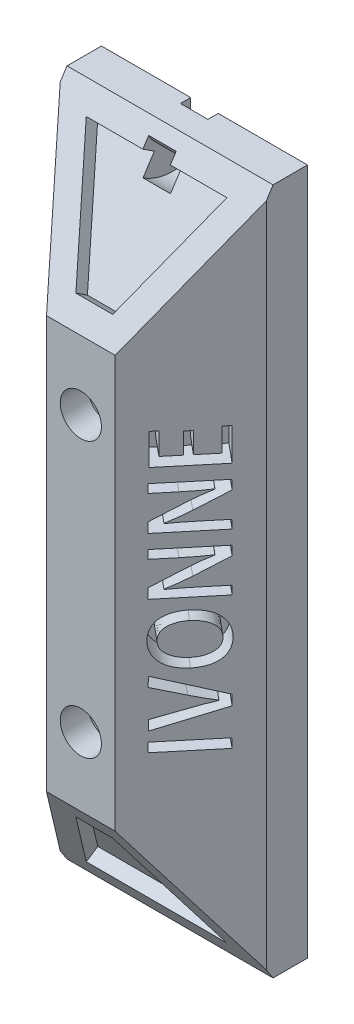
from build123d import *

# Parameters (mm, degrees)
SALIENTE_EXTRUIR1_DEPTH      = 50
CHAFL_N1_SIZE                = 10
CHAFL_N1_SIZE2               = 6.494075932
CORTAR_EXTRUIR1_DEPTH        = 1
CROQUIS4_R                   = 1.5
HUECOS_TORNILLOS_DEPTH       = 2
CROQUIS5_W                   = 0.666881583
CROQUIS5_H                   = 4.346222222
PUEBLA_1_DEPTH               = 1.8
PUEBLA_2_DEPTH               = 1.8
RANURA_LLAVERO_DEPTH         = 1
RANURA_LLAVERO_DEPTH_BACK    = 1
RANURA_LLAVERO_START         = -7.5
CROQUIS8_R                   = 4
CROQUIS8_R_2                 = 2
CROQUIS10_W                  = 2
CROQUIS10_H                  = 2
ESPACIO_LLAVERO_DEBAJO_DEPTH = 0.75
CROQUIS27_W                  = 5.291666667
CROQUIS27_H                  = 0.949786325
INVENTOTECA_DEBAJO_DEPTH     = 1
ROTAR_PARA_STL_ANGLE         = 90


with BuildPart() as part:
    # Croquis1 → Saliente-Extruir1 (new body)
    with BuildSketch(Plane.XY):
        Polygon((-7.5, 0), (7.5, 0), (7.5, 3), (2.5, 9), (-2.5, 9), (-7.5, 3), align=None)
    extrude(amount=SALIENTE_EXTRUIR1_DEPTH)

    # Chaflán1
    chafl_n1_edges = [part.edges().sort_by_distance(p)[0] for p in [
        (0, 9, 0),
        (0, 9, 50),
    ]]
    chafl_n1_side = [part.faces().sort_by_distance(p)[0] for p in [
        (0, 9, 25),
    ]]
    chamfer(chafl_n1_edges, length=CHAFL_N1_SIZE, length2=CHAFL_N1_SIZE2, reference=chafl_n1_side[0])

    # Croquis3 → Cortar-Extruir1 (cut)
    with BuildSketch(Plane(origin=(0, 24.601224047, 15.976221698), x_dir=(1, 0, 0), z_dir=(0, 0.838670567945425, 0.5446390350150255))):
        Polygon((-5.118051563, -38.768704331), (5.118051563, -38.768704331), (1.340238725, -30.445071403), (-1.340238725, -30.445071403), align=None)
    cortar_extruir1 = extrude(amount=-CORTAR_EXTRUIR1_DEPTH, mode=Mode.SUBTRACT)

    # Simetría1: Cortar-Extruir1 across plane
    add(cortar_extruir1.mirror(Plane.XY.offset(25)), mode=Mode.SUBTRACT)

    # Croquis4 → Huecos tornillos (cut)
    with BuildSketch(Plane(origin=(0, 9, 0), x_dir=(1, 0, 0), z_dir=(0, 1, 0))):
        with Locations(Location((0, -35, 0), (0, 0, 270))):
            Circle(CROQUIS4_R)
        with Locations(Location((0, -15, 0), (0, 0, 270))):
            Circle(CROQUIS4_R)
    extrude(amount=-HUECOS_TORNILLOS_DEPTH, mode=Mode.SUBTRACT)

    # Croquis5 → PUEBLA-1 (cut)
    # profile 1 of 6: a face of its own
    with BuildSketch(Plane(origin=(5.901639344, 4.918032787, 0), x_dir=(0, 0, -1), z_dir=(0.7682212795973757, 0.6401843996644802, 0))):
        with Locations((-34.829100393, 1.448221567)):
            Rectangle(CROQUIS5_W, CROQUIS5_H)
    # profile 2 of 6: a face of its own
    with BuildSketch(Plane(origin=(5.901639344, 4.918032787, 0), x_dir=(0, 0, -1), z_dir=(0.7682212795973757, 0.6401843996644802, 0))):
        with BuildLine():
            Line((-31.044933645, 3.616754674), (-31.658026888, 1.57311053))
            add(Edge.make_bspline(
                [(-31.658026888, 1.57311053), (-31.699446524, 1.433644653), (-31.781157246, 1.158512885), (-31.891992316, 0.747726513), (-31.991774138, 0.345276682), (-32.049946693, 0.078464754), (-32.078627409, -0.053081072)],
                knots=[0, 0, 0, 0, 1.039028323, 2.049746547, 3.038469889, 4, 4, 4, 4], degree=3))
            Line((-32.078627409, -0.053081072), (-32.095139663, -0.053081072))
            add(Edge.make_bspline(
                [(-32.095139663, -0.053081072), (-32.124240482, 0.078150514), (-32.182982573, 0.343050881), (-32.279959839, 0.742107749), (-32.386559732, 1.146590181), (-32.464636112, 1.416890509), (-32.504051355, 1.553346032)],
                knots=[0, 0, 0, 0, 0.972849241, 1.963765957, 2.972049415, 4, 4, 4, 4], degree=3))
            Line((-32.504051355, 1.553346032), (-33.07722421, 3.59709444))
            Line((-33.07722421, 3.59709444), (-33.79817645, 3.59709444))
            Line((-33.79817645, 3.59709444), (-32.481161335, -0.729817235))
            Line((-32.481161335, -0.729817235), (-31.748855517, -0.729817235))
            Line((-31.748855517, -0.729817235), (-30.341011773, 3.591417651))
            Line((-30.341011773, 3.591417651), (-31.044933645, 3.616754674))
        make_face()
    # profile 3 of 6: a face of its own
    with BuildSketch(Plane(origin=(5.901639344, 4.918032787, 0), x_dir=(0, 0, -1), z_dir=(0.7682212795973757, 0.6401843996644802, 0))):
        with BuildLine():
            add(Edge.make_bspline(
                [(-28.095886524, 3.677590478), (-28.16565393, 3.674703661), (-28.301888525, 3.669066582), (-28.500351425, 3.637948978), (-28.687856415, 3.590127123), (-28.8638204, 3.52225787), (-29.028802196, 3.436338959), (-29.182192859, 3.331377227), (-29.324241089, 3.208101346), (-29.454105977, 3.067251959), (-29.570480894, 2.910143798), (-29.67311558, 2.738438791), (-29.758767264, 2.551927808), (-29.830719285, 2.352304173), (-29.886017097, 2.138566438), (-29.926974813, 1.911296671), (-29.952499422, 1.669980416), (-29.957272341, 1.504404939), (-29.959720492, 1.419477107)],
                knots=[0, 0, 0, 0, 1.01693825, 1.985772131, 2.921518734, 3.832117633, 4.727948323, 5.626511184, 6.534414133, 7.463288783, 8.412839634, 9.378967074, 10.373196777, 11.399194858, 12.46754142, 13.586614818, 14.762113956, 16, 16, 16, 16], degree=3))
            add(Edge.make_bspline(
                [(-29.959720492, 1.419477107), (-29.957959694, 1.337819287), (-29.954518503, 1.17823251), (-29.928486567, 0.945750412), (-29.892381825, 0.725692531), (-29.837861372, 0.519245698), (-29.771826152, 0.324732128), (-29.687815848, 0.14447415), (-29.591815406, -0.024079988), (-29.480090002, -0.177828714), (-29.356409881, -0.317585189), (-29.219188749, -0.438958806), (-29.070392155, -0.542422431), (-28.909692435, -0.627705163), (-28.737003324, -0.69427954), (-28.552716146, -0.742476394), (-28.357044742, -0.773496795), (-28.222552549, -0.77882904), (-28.153721922, -0.781557985)],
                knots=[0, 0, 0, 0, 1.222557966, 2.38928844, 3.500048728, 4.559063003, 5.583344684, 6.572073494, 7.532658458, 8.483942143, 9.413076429, 10.322121769, 11.220566177, 12.121066096, 13.040014193, 13.985715855, 14.969126498, 16, 16, 16, 16], degree=3))
            add(Edge.make_bspline(
                [(-28.153721922, -0.781557985), (-28.087107481, -0.779835617), (-27.95635761, -0.776454977), (-27.765180171, -0.749513275), (-27.583334661, -0.706435416), (-27.411328861, -0.644593489), (-27.249400548, -0.564115067), (-27.096650747, -0.46690389), (-26.953736911, -0.351514936), (-26.820184012, -0.219547438), (-26.700208049, -0.068410971), (-26.593960448, 0.10020548), (-26.505916186, 0.288281456), (-26.432018411, 0.493369189), (-26.373836577, 0.716604884), (-26.33195802, 0.957517677), (-26.304433586, 1.216558697), (-26.29940249, 1.395314512), (-26.296803884, 1.487643492)],
                knots=[0, 0, 0, 0, 0.964759122, 1.89361537, 2.791129421, 3.668077106, 4.535429534, 5.405715028, 6.285894481, 7.191747456, 8.120239528, 9.075412678, 10.072429751, 11.12252868, 12.229792465, 13.410030886, 14.662257747, 16, 16, 16, 16], degree=3))
            add(Edge.make_bspline(
                [(-26.296803884, 1.487643492), (-26.298165742, 1.566264847), (-26.300828705, 1.720000314), (-26.323297248, 1.944837442), (-26.360382951, 2.157968607), (-26.41002484, 2.360356427), (-26.47484973, 2.551468015), (-26.554699401, 2.731206929), (-26.648962122, 2.899545815), (-26.755555285, 3.056601694), (-26.877422584, 3.198416988), (-27.01244475, 3.323110416), (-27.160793404, 3.42975367), (-27.323245735, 3.515553187), (-27.497756084, 3.58569348), (-27.686017754, 3.634760278), (-27.886806122, 3.667627428), (-28.025196732, 3.673940275), (-28.095886524, 3.677590478)],
                knots=[0, 0, 0, 0, 1.181997023, 2.311265979, 3.393394717, 4.432710499, 5.441572568, 6.423779709, 7.385757606, 8.339154063, 9.273212536, 10.190881701, 11.096730823, 12.012033381, 12.946898792, 13.918455472, 14.931549697, 16, 16, 16, 16], degree=3))
        make_face()
        with BuildLine():
            add(Edge.make_bspline(
                [(-28.118892037, 3.161002653), (-28.071512916, 3.156951548), (-27.978895026, 3.149032346), (-27.844708896, 3.120274594), (-27.720098234, 3.075968915), (-27.604941745, 3.016181642), (-27.500319293, 2.940460494), (-27.403837196, 2.851175381), (-27.318204101, 2.745795054), (-27.243781815, 2.626559028), (-27.178036276, 2.498359312), (-27.120843599, 2.364198736), (-27.070765031, 2.226045945), (-27.032031568, 2.082448402), (-27.000187523, 1.934815112), (-26.979607876, 1.782117173), (-26.965703299, 1.625057467), (-26.96436374, 1.51860995), (-26.963684666, 1.464647603)],
                knots=[0, 0, 0, 0, 0.999589655, 1.954022852, 2.877517249, 3.773878129, 4.673599429, 5.586311784, 6.531597741, 7.520501744, 8.537853166, 9.559417173, 10.586727125, 11.626167667, 12.685579831, 13.761408337, 14.865171654, 16, 16, 16, 16], degree=3))
            add(Edge.make_bspline(
                [(-26.963684666, 1.464647603), (-26.964748552, 1.405768414), (-26.966834463, 1.290326859), (-26.979747644, 1.120494803), (-27.002863157, 0.95789967), (-27.034489952, 0.801880421), (-27.076813162, 0.653415905), (-27.126307997, 0.511310028), (-27.186997569, 0.377126038), (-27.254794766, 0.250259062), (-27.332501035, 0.134116855), (-27.419449573, 0.031661097), (-27.51603858, -0.055935421), (-27.621401502, -0.1285927), (-27.736206003, -0.185943493), (-27.859826469, -0.227451483), (-27.992033451, -0.256501038), (-28.083757864, -0.262103157), (-28.130726033, -0.264971764)],
                knots=[0, 0, 0, 0, 1.215141369, 2.382468418, 3.512223075, 4.602497428, 5.664896563, 6.695933009, 7.704955915, 8.700973005, 9.661508233, 10.583141316, 11.467103885, 12.344670232, 13.216342825, 14.106081872, 15.030205112, 16, 16, 16, 16], degree=3))
            add(Edge.make_bspline(
                [(-28.130726033, -0.264971764), (-28.176863196, -0.261728608), (-28.267184607, -0.255379575), (-28.397927132, -0.226735966), (-28.520422776, -0.18428753), (-28.633727588, -0.126116877), (-28.738811667, -0.053984434), (-28.833999579, 0.034166827), (-28.922189649, 0.135814411), (-28.998687757, 0.252541056), (-29.067275621, 0.378648681), (-29.127067231, 0.511920214), (-29.178558591, 0.651135229), (-29.218847014, 0.796971302), (-29.252334036, 0.948158797), (-29.274719795, 1.105489402), (-29.289172555, 1.268638096), (-29.291058377, 1.37947624), (-29.292018429, 1.435902742)],
                knots=[0, 0, 0, 0, 0.968573833, 1.896149455, 2.796477749, 3.679461465, 4.558257033, 5.460120664, 6.392036362, 7.372592241, 8.379386201, 9.399199485, 10.432362265, 11.48798156, 12.568687675, 13.676620176, 14.817192429, 16, 16, 16, 16], degree=3))
            add(Edge.make_bspline(
                [(-29.292018429, 1.435902742), (-29.291675932, 1.490960072), (-29.290998413, 1.599873071), (-29.276923274, 1.760487246), (-29.256303781, 1.916713225), (-29.224695668, 2.067432112), (-29.185440967, 2.213487663), (-29.136947631, 2.354695724), (-29.078379989, 2.490508452), (-29.012881494, 2.62099997), (-28.937702264, 2.741583121), (-28.850709063, 2.848086982), (-28.753397428, 2.93889665), (-28.646047321, 3.014873272), (-28.528383149, 3.074985104), (-28.400902287, 3.120302247), (-28.263423937, 3.150432938), (-28.168109028, 3.157149779), (-28.118892037, 3.161002653)],
                knots=[0, 0, 0, 0, 1.136547726, 2.248289582, 3.326834991, 4.389002452, 5.425786828, 6.448433384, 7.469124786, 8.477926495, 9.461316408, 10.397265518, 11.309260955, 12.201738065, 13.104381261, 14.028854752, 14.989125284, 16, 16, 16, 16], degree=3))
        make_face(mode=Mode.SUBTRACT)
    # profile 4 of 6: a face of its own
    with BuildSketch(Plane(origin=(5.901639344, 4.918032787, 0), x_dir=(0, 0, -1), z_dir=(0.7682212795973757, 0.6401843996644802, 0))):
        with BuildLine():
            Line((-22.353831002, 3.621332678), (-22.968150553, 3.621332678))
            Line((-22.968150553, 3.621332678), (-22.968150553, 2.019323973))
            add(Edge.make_bspline(
                [(-22.968150553, 2.019323973), (-22.968422741, 1.934352967), (-22.96895716, 1.767518782), (-22.96509493, 1.521574845), (-22.96029327, 1.284217603), (-22.951838542, 0.979418847), (-22.934273891, 0.605224022), (-22.911397472, 0.307960084), (-22.899982564, 0.159630901)],
                knots=[0, 0, 0, 0, 0.821614023, 1.613177398, 2.378363483, 3.117216942, 4.56154481, 6, 6, 6, 6], degree=3))
            Line((-22.899982564, 0.159630901), (-22.91644429, 0.154316631))
            add(Edge.make_bspline(
                [(-22.91644429, 0.154316631), (-22.966176072, 0.273383065), (-23.067647266, 0.516322549), (-23.239367733, 0.878777373), (-23.423438637, 1.246232332), (-23.558281636, 1.487856823), (-23.625995631, 1.609193191)],
                knots=[0, 0, 0, 0, 0.955842181, 1.950270942, 2.970689279, 4, 4, 4, 4], degree=3))
            Line((-23.625995631, 1.609193191), (-24.768213277, 3.626260369))
            Line((-24.768213277, 3.626260369), (-25.491127289, 3.626260369))
            Line((-25.491127289, 3.626260369), (-25.491127289, -0.729817235))
            Line((-25.491127289, -0.729817235), (-24.876807737, -0.729817235))
            Line((-24.876807737, -0.729817235), (-24.876807737, 0.890671913))
            add(Edge.make_bspline(
                [(-24.876807737, 0.890671913), (-24.877033977, 0.983443472), (-24.877475191, 1.164367387), (-24.878912513, 1.428792907), (-24.882117927, 1.67901992), (-24.888814353, 1.989761231), (-24.899210027, 2.358125231), (-24.915074233, 2.647593449), (-24.922799515, 2.788553785)],
                knots=[0, 0, 0, 0, 0.879484195, 1.715177864, 2.506803862, 3.251809647, 4.661732754, 6, 6, 6, 6], degree=3))
            Line((-24.922799515, 2.788553785), (-24.899771545, 2.794646829))
            add(Edge.make_bspline(
                [(-24.899771545, 2.794646829), (-24.847097234, 2.669266241), (-24.740581837, 2.415727793), (-24.561916578, 2.041245353), (-24.372442614, 1.670054756), (-24.240252789, 1.425790794), (-24.174611841, 1.304497662)],
                knots=[0, 0, 0, 0, 0.984107413, 1.990013513, 3.00190943, 4, 4, 4, 4], degree=3))
            Line((-24.174611841, 1.304497662), (-23.025295401, -0.729817235))
            Line((-23.025295401, -0.729817235), (-22.353831002, -0.729817235))
            Line((-22.353831002, -0.729817235), (-22.353831002, 3.621332678))
        make_face()
    # profile 5 of 6: a face of its own
    with BuildSketch(Plane(origin=(5.901639344, 4.918032787, 0), x_dir=(0, 0, -1), z_dir=(0.7682212795973757, 0.6401843996644802, 0))):
        with BuildLine():
            Line((-18.20143047, 3.621332678), (-18.815750022, 3.621332678))
            Line((-18.815750022, 3.621332678), (-18.815750022, 2.019323973))
            add(Edge.make_bspline(
                [(-18.815750022, 2.019323973), (-18.816022209, 1.934352967), (-18.816556629, 1.767518782), (-18.812694399, 1.521574845), (-18.807892738, 1.284217603), (-18.799438011, 0.979418847), (-18.78187336, 0.605224022), (-18.758996941, 0.307960084), (-18.747582033, 0.159630901)],
                knots=[0, 0, 0, 0, 0.821614023, 1.613177398, 2.378363483, 3.117216942, 4.56154481, 6, 6, 6, 6], degree=3))
            Line((-18.747582033, 0.159630901), (-18.764043759, 0.154316631))
            add(Edge.make_bspline(
                [(-18.764043759, 0.154316631), (-18.81377554, 0.273383065), (-18.915246735, 0.516322549), (-19.086967202, 0.878777373), (-19.271038106, 1.246232332), (-19.405881105, 1.487856823), (-19.4735951, 1.609193191)],
                knots=[0, 0, 0, 0, 0.955842181, 1.950270942, 2.970689279, 4, 4, 4, 4], degree=3))
            Line((-19.4735951, 1.609193191), (-20.615812746, 3.626260369))
            Line((-20.615812746, 3.626260369), (-21.338726758, 3.626260369))
            Line((-21.338726758, 3.626260369), (-21.338726758, -0.729817235))
            Line((-21.338726758, -0.729817235), (-20.724407206, -0.729817235))
            Line((-20.724407206, -0.729817235), (-20.724407206, 0.890671913))
            add(Edge.make_bspline(
                [(-20.724407206, 0.890671913), (-20.724633446, 0.983443472), (-20.72507466, 1.164367387), (-20.726511982, 1.428792907), (-20.729717396, 1.67901992), (-20.736413822, 1.989761231), (-20.746809496, 2.358125231), (-20.762673702, 2.647593449), (-20.770398984, 2.788553785)],
                knots=[0, 0, 0, 0, 0.879484195, 1.715177864, 2.506803862, 3.251809647, 4.661732754, 6, 6, 6, 6], degree=3))
            Line((-20.770398984, 2.788553785), (-20.747371014, 2.794646829))
            add(Edge.make_bspline(
                [(-20.747371014, 2.794646829), (-20.694696703, 2.669266241), (-20.588181306, 2.415727793), (-20.409516047, 2.041245353), (-20.220042083, 1.670054756), (-20.087852258, 1.425790794), (-20.02221131, 1.304497662)],
                knots=[0, 0, 0, 0, 0.984107413, 1.990013513, 3.00190943, 4, 4, 4, 4], degree=3))
            Line((-20.02221131, 1.304497662), (-18.87289487, -0.729817235))
            Line((-18.87289487, -0.729817235), (-18.20143047, -0.729817235))
            Line((-18.20143047, -0.729817235), (-18.20143047, 3.621332678))
        make_face()
    # profile 6 of 6: a face of its own
    with BuildSketch(Plane(origin=(5.901639344, 4.918032787, 0), x_dir=(0, 0, -1), z_dir=(0.7682212795973757, 0.6401843996644802, 0))):
        Polygon((-14.810731067, -0.211998289), (-16.519444643, -0.211998289), (-16.519444643, 1.268770301), (-14.998065114, 1.268770301), (-14.998065114, 1.785358127), (-16.519444643, 1.785358127), (-16.519444643, 3.055878589), (-14.907236485, 3.055878589), (-14.907236485, 3.572466414), (-17.186326227, 3.572466414), (-17.186326227, -0.728586114), (-14.810731067, -0.728586114), align=None)
    extrude(amount=-PUEBLA_1_DEPTH, mode=Mode.SUBTRACT)

    # Croquis7 → PUEBLA-2 (cut)
    # profile 1 of 6: a face of its own
    with BuildSketch(Plane(origin=(-5.901639344, 4.918032787, 0), x_dir=(0, 0, 1), z_dir=(-0.7682212795973757, 0.6401843996644802, 0))):
        with BuildLine():
            Line((14.784896784, -0.728547254), (15.451778367, -0.728547254))
            Line((15.451778367, -0.728547254), (15.451778367, 0.974180749))
            add(Edge.make_bspline(
                [(15.451778367, 0.974180749), (15.479649087, 0.969236748), (15.537061979, 0.959052245), (15.626564776, 0.950753646), (15.721366907, 0.945554573), (15.786305691, 0.945648321), (15.819712592, 0.945696549)],
                knots=[0, 0, 0, 0, 0.918571729, 1.892231672, 2.915686383, 4, 4, 4, 4], degree=3))
            add(Edge.make_bspline(
                [(15.819712592, 0.945696549), (15.870388914, 0.945724228), (15.97055983, 0.94577894), (16.118738391, 0.959670366), (16.263190986, 0.982345226), (16.403847566, 1.015986552), (16.540641355, 1.060797786), (16.673868346, 1.114904749), (16.803241441, 1.179284973), (16.927989135, 1.253088297), (17.044445678, 1.33944952), (17.147471564, 1.441403104), (17.234751392, 1.558270637), (17.307710526, 1.688949237), (17.365805129, 1.833333354), (17.409189057, 1.991763888), (17.438096909, 2.164059154), (17.444833096, 2.283998338), (17.448314303, 2.345981934)],
                knots=[0, 0, 0, 0, 1.002223409, 1.981075816, 2.941057117, 3.893567037, 4.839120738, 5.786658294, 6.736252809, 7.695867274, 8.651375827, 9.597441389, 10.552949943, 11.527852714, 12.550822771, 13.624507394, 14.772364707, 16, 16, 16, 16], degree=3))
            add(Edge.make_bspline(
                [(17.448314303, 2.345981934), (17.446179168, 2.394510672), (17.442011002, 2.489247473), (17.421235816, 2.626762618), (17.389266165, 2.755805686), (17.345887418, 2.876709323), (17.289686702, 2.988600376), (17.222653702, 3.092465215), (17.143832035, 3.187785686), (17.082474587, 3.242995652), (17.051635218, 3.270745185)],
                knots=[0, 0, 0, 0, 1.121960372, 2.190267843, 3.207584746, 4.190239261, 5.152208329, 6.094546313, 7.042284316, 8, 8, 8, 8], degree=3))
            add(Edge.make_bspline(
                [(17.051635218, 3.270745185), (17.016952224, 3.298731673), (16.946495047, 3.355585154), (16.826534971, 3.425932051), (16.69479849, 3.485606729), (16.550814177, 3.535204926), (16.394020658, 3.572753107), (16.224702151, 3.597909169), (16.04318639, 3.615259844), (15.918036956, 3.616622263), (15.853385143, 3.617326084)],
                knots=[0, 0, 0, 0, 0.838628006, 1.70364077, 2.610636308, 3.559859354, 4.568055018, 5.643200099, 6.782484425, 8, 8, 8, 8], degree=3))
            add(Edge.make_bspline(
                [(15.853385143, 3.617326084), (15.798904277, 3.616347806), (15.692664664, 3.61444013), (15.537682814, 3.609712771), (15.391181981, 3.602440724), (15.25322065, 3.592351175), (15.123638459, 3.581283174), (15.002589421, 3.567296885), (14.890302472, 3.551073558), (14.818537901, 3.538128867), (14.784076304, 3.531912782)],
                knots=[0, 0, 0, 0, 1.217605855, 2.374374404, 3.464660226, 4.494999595, 5.465333604, 6.370582827, 7.217548217, 8, 8, 8, 8], degree=3))
            Line((14.784076304, 3.531912782), (14.784896784, -0.728547254))
        make_face()
        with BuildLine():
            add(Edge.make_bspline(
                [(15.451778367, 3.061940716), (15.477458014, 3.066999921), (15.535600933, 3.078454789), (15.634998692, 3.088975362), (15.756359022, 3.097021773), (15.844882289, 3.099433961), (15.892806667, 3.100739862)],
                knots=[0, 0, 0, 0, 0.7081459, 1.603358068, 2.702515415, 4, 4, 4, 4], degree=3))
            add(Edge.make_bspline(
                [(15.892806667, 3.100739862), (15.925402935, 3.100059102), (15.989080716, 3.098729215), (16.082194342, 3.089818951), (16.170284081, 3.074138278), (16.253491127, 3.052795472), (16.331865308, 3.02610562), (16.404867049, 2.991858619), (16.472939866, 2.951893235), (16.535615875, 2.905588177), (16.592916539, 2.854060564), (16.6422308, 2.795232649), (16.684691459, 2.730579305), (16.7190514, 2.659519427), (16.7462214, 2.582653608), (16.765834456, 2.499791745), (16.778255916, 2.410954941), (16.780355219, 2.349582306), (16.781433522, 2.318058354)],
                knots=[0, 0, 0, 0, 1.16517395, 2.276202082, 3.339667925, 4.360262278, 5.344409501, 6.294443781, 7.237649562, 8.161467064, 9.075802852, 9.985465996, 10.897442204, 11.83402534, 12.799705885, 13.806079676, 14.873096483, 16, 16, 16, 16], degree=3))
            add(Edge.make_bspline(
                [(16.781433522, 2.318058354), (16.780331411, 2.284624958), (16.77818289, 2.219447885), (16.766037749, 2.1247713), (16.74534889, 2.03626464), (16.717396737, 1.953694268), (16.682319389, 1.876728647), (16.638246382, 1.806205479), (16.586102543, 1.741979405), (16.526818461, 1.683321026), (16.460251877, 1.631673222), (16.386945276, 1.587186303), (16.308067555, 1.548225155), (16.222344642, 1.517168035), (16.130335292, 1.493769508), (16.032485225, 1.475343362), (15.92806913, 1.464940187), (15.856418101, 1.463182963), (15.819712592, 1.46228277)],
                knots=[0, 0, 0, 0, 1.098810706, 2.142087657, 3.130558938, 4.080710143, 5.002414742, 5.90351999, 6.805477983, 7.715119197, 8.638227497, 9.567016518, 10.528554789, 11.524610674, 12.556657526, 13.645294696, 14.7937276, 16, 16, 16, 16], degree=3))
            add(Edge.make_bspline(
                [(15.819712592, 1.46228277), (15.783838455, 1.46215923), (15.715320982, 1.461923276), (15.618009798, 1.467773977), (15.530739349, 1.477388261), (15.477149605, 1.489989473), (15.451778367, 1.495955322)],
                knots=[0, 0, 0, 0, 1.161542367, 2.218477041, 3.156565424, 4, 4, 4, 4], degree=3))
            Line((15.451778367, 1.495955322), (15.451778367, 3.061940716))
        make_face(mode=Mode.SUBTRACT)
    # profile 2 of 6: a face of its own
    with BuildSketch(Plane(origin=(-5.901639344, 4.918032787, 0), x_dir=(0, 0, 1), z_dir=(-0.7682212795973757, 0.6401843996644802, 0))):
        with BuildLine():
            Line((21.338725154, 3.594040661), (20.67184357, 3.594040661))
            Line((20.67184357, 3.594040661), (20.67184357, 0.96568722))
            add(Edge.make_bspline(
                [(20.67184357, 0.96568722), (20.670344571, 0.913835752), (20.667440856, 0.81339417), (20.656438589, 0.668187154), (20.637725128, 0.533725361), (20.611704638, 0.410118429), (20.578263822, 0.297074009), (20.537391283, 0.194981263), (20.489488882, 0.103425588), (20.434564862, 0.022452272), (20.372145654, -0.047802667), (20.304755279, -0.109211986), (20.23119013, -0.160312362), (20.152053056, -0.202040322), (20.067227678, -0.233747224), (19.977007568, -0.257065903), (19.881067112, -0.270173821), (19.815287553, -0.271555951), (19.781575757, -0.272264287)],
                knots=[0, 0, 0, 0, 1.438585386, 2.786686621, 4.036552978, 5.201082612, 6.286862056, 7.302011853, 8.246194207, 9.147550894, 10.00824043, 10.846879081, 11.670430889, 12.485539397, 13.321768657, 14.176240106, 15.065329361, 16, 16, 16, 16], degree=3))
            add(Edge.make_bspline(
                [(19.781575757, -0.272264287), (19.750320718, -0.271901843), (19.689150878, -0.271192498), (19.599783951, -0.257740325), (19.515263468, -0.234523239), (19.435132311, -0.202206839), (19.359012765, -0.161455043), (19.288835008, -0.10942559), (19.222629615, -0.049035341), (19.160868087, 0.020718107), (19.105307553, 0.10140995), (19.057283349, 0.192788231), (19.015700483, 0.295023948), (18.983048473, 0.408366404), (18.955568039, 0.532277433), (18.936456753, 0.667087865), (18.923979896, 0.81269346), (18.921931424, 0.913365624), (18.920872482, 0.965407311)],
                knots=[0, 0, 0, 0, 0.880620858, 1.723480129, 2.540049658, 3.347149052, 4.155502796, 4.967718036, 5.803797264, 6.678919068, 7.589027408, 8.559476972, 9.584493291, 10.69587747, 11.881568968, 13.161133164, 14.532470029, 16, 16, 16, 16], degree=3))
            Line((18.920872482, 0.965407311), (18.920872482, 3.594040661))
            Line((18.920872482, 3.594040661), (18.253990898, 3.594040661))
            Line((18.253990898, 3.594040661), (18.253990898, 1.005424745))
            add(Edge.make_bspline(
                [(18.253990898, 1.005424745), (18.255679837, 0.927970745), (18.25894061, 0.778433144), (18.280640329, 0.56285405), (18.313771248, 0.364027903), (18.359309913, 0.181964958), (18.417293993, 0.016667686), (18.4880826, -0.131682311), (18.571200409, -0.263581208), (18.667177235, -0.378625039), (18.774028522, -0.477361026), (18.889082518, -0.562850203), (19.013100737, -0.634697264), (19.14596537, -0.692950344), (19.287063789, -0.738507941), (19.43688367, -0.769183087), (19.594930597, -0.787937967), (19.703226031, -0.788541844), (19.758579868, -0.788850508)],
                knots=[0, 0, 0, 0, 1.38962604, 2.682900096, 3.883708864, 5.003577014, 6.046051179, 7.021519621, 7.946782916, 8.836077995, 9.701502405, 10.551298335, 11.403065278, 12.267387725, 13.149723428, 14.058184006, 15.007465389, 16, 16, 16, 16], degree=3))
            add(Edge.make_bspline(
                [(19.758579868, -0.788850508), (19.816399624, -0.788274185), (19.929363758, -0.787148205), (20.094242877, -0.767572176), (20.250524877, -0.735911185), (20.398044536, -0.690263513), (20.536286113, -0.629206856), (20.666763255, -0.556748621), (20.787110006, -0.468286382), (20.899991479, -0.36815304), (21.001724586, -0.251677169), (21.089883419, -0.11810524), (21.164665605, 0.031745997), (21.226195617, 0.198120896), (21.274126192, 0.380848286), (21.308762009, 0.580045987), (21.332383138, 0.795401478), (21.336022541, 0.944808997), (21.337904674, 1.022075752)],
                knots=[0, 0, 0, 0, 1.011965347, 1.977106012, 2.902281606, 3.801441794, 4.675206323, 5.544580214, 6.409541179, 7.285433736, 8.18245704, 9.109221175, 10.080450816, 11.108962635, 12.210199246, 13.38382548, 14.647033859, 16, 16, 16, 16], degree=3))
            Line((21.337904674, 1.022075752), (21.338725154, 3.594040661))
        make_face()
    # profile 3 of 6: a face of its own
    with BuildSketch(Plane(origin=(-5.901639344, 4.918032787, 0), x_dir=(0, 0, 1), z_dir=(-0.7682212795973757, 0.6401843996644802, 0))):
        Polygon((24.729424557, -0.219290812), (23.020710981, -0.219290812), (23.020710981, 1.261477778), (24.54209051, 1.261477778), (24.54209051, 1.778065603), (23.020710981, 1.778065603), (23.020710981, 3.048586065), (24.632919139, 3.048586065), (24.632919139, 3.56517389), (22.353829397, 3.56517389), (22.353829397, -0.735878638), (24.729424557, -0.735878638), align=None)
    # profile 4 of 6: a face of its own
    with BuildSketch(Plane(origin=(-5.901639344, 4.918032787, 0), x_dir=(0, 0, 1), z_dir=(-0.7682212795973757, 0.6401843996644802, 0))):
        with BuildLine():
            add(Edge.make_bspline(
                [(27.427912571, 1.600288581), (27.457304513, 1.611091676), (27.51499113, 1.632294562), (27.596974007, 1.670456731), (27.674335394, 1.711640989), (27.74604166, 1.757174888), (27.812449258, 1.807236199), (27.874162796, 1.860223711), (27.930244684, 1.917933777), (27.980136332, 1.979509761), (28.024529145, 2.043967058), (28.06432428, 2.110230105), (28.097196457, 2.179314638), (28.123294998, 2.250722633), (28.145244396, 2.323760192), (28.159512944, 2.399480878), (28.168998425, 2.477147825), (28.170306483, 2.529646513), (28.170968839, 2.556230062)],
                knots=[0, 0, 0, 0, 1.158010079, 2.272789037, 3.3421568, 4.398545089, 5.411311129, 6.416452725, 7.404821061, 8.383909716, 9.344703944, 10.298264987, 11.240518476, 12.169838246, 13.108875005, 14.058285776, 15.016782025, 16, 16, 16, 16], degree=3))
            add(Edge.make_bspline(
                [(28.170968839, 2.556230062), (28.172279888, 2.586360359), (28.174920164, 2.647038747), (28.1648979, 2.738188909), (28.146460736, 2.829594294), (28.115096551, 2.92003336), (28.074763229, 3.011315638), (28.022727489, 3.10198126), (27.960430361, 3.19266422), (27.888837475, 3.283911598), (27.800622897, 3.371228404), (27.6891127, 3.445819599), (27.557141455, 3.509217149), (27.405275975, 3.563523581), (27.232137514, 3.604855416), (27.039154019, 3.638773151), (26.824753378, 3.660200303), (26.674911301, 3.666562085), (26.596571723, 3.669888116)],
                knots=[0, 0, 0, 0, 0.662582201, 1.334351894, 2.01115102, 2.710095991, 3.435323525, 4.2039863, 5.00579069, 5.854169704, 6.752811591, 7.723346771, 8.789937867, 9.967205469, 11.26427748, 12.700938597, 14.275203597, 16, 16, 16, 16], degree=3))
            add(Edge.make_bspline(
                [(26.596571723, 3.669888116), (26.498805662, 3.668361581), (26.307727032, 3.665378049), (26.0730719, 3.648489356), (25.896136507, 3.629630675), (25.774738941, 3.614322774), (25.663624979, 3.596253201), (25.59293774, 3.582708731), (25.559292872, 3.576261996)],
                knots=[0, 0, 0, 0, 1.687173059, 3.297491112, 4.057661749, 4.757936521, 5.408817464, 6, 6, 6, 6], degree=3))
            Line((25.559292872, 3.576261996), (25.560113352, -0.736201857))
            add(Edge.make_bspline(
                [(25.560113352, -0.736201857), (25.585547474, -0.739997093), (25.639571911, -0.748058528), (25.725952737, -0.756403848), (25.821729996, -0.765002982), (25.927225423, -0.770834209), (26.042143949, -0.778075993), (26.166755119, -0.782405338), (26.300610405, -0.786916615), (26.392889841, -0.788192068), (26.440528191, -0.788850508)],
                knots=[0, 0, 0, 0, 0.699185398, 1.485134748, 2.359315875, 3.314070099, 4.357999124, 5.490443077, 6.704465959, 8, 8, 8, 8], degree=3))
            add(Edge.make_bspline(
                [(26.440528191, -0.788850508), (26.48378965, -0.788923283), (26.568701305, -0.78906612), (26.693539879, -0.783382296), (26.813576544, -0.776736153), (26.928598488, -0.76501384), (27.038367936, -0.750117718), (27.143461599, -0.733282693), (27.243151078, -0.711870868), (27.33801951, -0.687356338), (27.427435692, -0.659109285), (27.512380306, -0.629476055), (27.591546737, -0.594292022), (27.666137843, -0.557009696), (27.735789358, -0.515838622), (27.799466933, -0.470372146), (27.859339319, -0.423036282), (27.895295218, -0.388103169), (27.913086369, -0.370818097)],
                knots=[0, 0, 0, 0, 1.322760237, 2.59625459, 3.820847638, 4.998735831, 6.130623795, 7.208270984, 8.252558636, 9.247527692, 10.203409462, 11.119645776, 11.996881918, 12.850511325, 13.668888328, 14.467895536, 15.241907374, 16, 16, 16, 16], degree=3))
            add(Edge.make_bspline(
                [(27.913086369, -0.370818097), (27.934033209, -0.350679608), (27.977990659, -0.3084185), (28.03861953, -0.233634953), (28.097299965, -0.145758404), (28.156484425, -0.046274736), (28.207947848, 0.069052468), (28.245368869, 0.201407126), (28.268775719, 0.349753118), (28.273582064, 0.454207549), (28.276092903, 0.508774658)],
                knots=[0, 0, 0, 0, 0.711698037, 1.493515599, 2.35333271, 3.30048251, 4.327872579, 5.4385067, 6.661873096, 8, 8, 8, 8], degree=3))
            add(Edge.make_bspline(
                [(28.276092903, 0.508774658), (28.274373239, 0.546036005), (28.271025285, 0.618578785), (28.258270066, 0.72447263), (28.236390449, 0.823945101), (28.209164698, 0.918373297), (28.17234641, 1.00620298), (28.130231119, 1.089193597), (28.078530193, 1.164784732), (28.021020206, 1.234833489), (27.957672357, 1.298412998), (27.891153842, 1.35671313), (27.821936669, 1.409728807), (27.749391173, 1.456562791), (27.673862187, 1.498057024), (27.594317222, 1.532075841), (27.512640376, 1.562378214), (27.456059678, 1.576670867), (27.427708855, 1.583832469)],
                knots=[0, 0, 0, 0, 1.205821652, 2.347570949, 3.442991661, 4.495930151, 5.519937987, 6.51755612, 7.49950264, 8.474121847, 9.444229276, 10.39759717, 11.33229336, 12.260302398, 13.187086564, 14.114546721, 15.055258179, 16, 16, 16, 16], degree=3))
            Line((27.427708855, 1.583832469), (27.427912571, 1.600288581))
        make_face()
        with BuildLine():
            Line((26.226994935, 1.779296724), (26.226994935, 3.1189813))
            add(Edge.make_bspline(
                [(26.226994935, 3.1189813), (26.237376504, 3.121480625), (26.259923636, 3.126908766), (26.297159993, 3.133604956), (26.340866843, 3.137848569), (26.390906942, 3.143154438), (26.447614778, 3.146972396), (26.51057095, 3.150539447), (26.579875371, 3.151609452), (26.628055607, 3.152720915), (26.653240164, 3.153301895)],
                knots=[0, 0, 0, 0, 0.598125682, 1.299034808, 2.116997753, 3.056965804, 4.117876534, 5.300287432, 6.588818354, 8, 8, 8, 8], degree=3))
            add(Edge.make_bspline(
                [(26.653240164, 3.153301895), (26.706982181, 3.153073832), (26.811774752, 3.152629129), (26.964389556, 3.128258542), (27.106876897, 3.085176014), (27.217933297, 3.034910316), (27.297923748, 2.982299925), (27.351257224, 2.935384468), (27.395997753, 2.879272351), (27.432980164, 2.81549156), (27.462499309, 2.744192649), (27.4848695, 2.665436734), (27.498353308, 2.578543132), (27.502125523, 2.517946933), (27.504088058, 2.486421113)],
                knots=[0, 0, 0, 0, 1.568793518, 3.05902002, 4.496583038, 5.910283965, 6.602575845, 7.288225433, 7.9766698, 8.690178237, 9.436053456, 10.226181897, 11.077152205, 12, 12, 12, 12], degree=3))
            add(Edge.make_bspline(
                [(27.504088058, 2.486421113), (27.502951902, 2.46091218), (27.500717372, 2.41074256), (27.488720885, 2.337384437), (27.471557869, 2.267241155), (27.444323347, 2.201825255), (27.411400987, 2.139891474), (27.371951833, 2.08113616), (27.324696439, 2.026663861), (27.27048762, 1.976821289), (27.210169996, 1.93157236), (27.144539642, 1.890950204), (27.07261382, 1.857607194), (26.995944089, 1.829700634), (26.913926944, 1.807009031), (26.826067217, 1.792447341), (26.733195926, 1.780908144), (26.669430901, 1.779299222), (26.636814529, 1.778476244)],
                knots=[0, 0, 0, 0, 0.975427607, 1.918419381, 2.837405929, 3.729535512, 4.619205739, 5.516233806, 6.429000407, 7.369665814, 8.326325266, 9.308245348, 10.314901143, 11.351316717, 12.425366266, 13.562823508, 14.753362722, 16, 16, 16, 16], degree=3))
            Line((26.636814529, 1.778476244), (26.226994935, 1.779296724))
        make_face(mode=Mode.SUBTRACT)
        with BuildLine():
            Line((26.226994935, 1.312808689), (26.614378459, 1.312808689))
            add(Edge.make_bspline(
                [(26.614378459, 1.312808689), (26.646229576, 1.312296431), (26.709383706, 1.311280731), (26.802871038, 1.304376544), (26.893223241, 1.289785034), (26.9808127, 1.271660165), (27.06466495, 1.245321091), (27.146439946, 1.215684201), (27.224527191, 1.177918983), (27.299862199, 1.136327164), (27.369256135, 1.087071777), (27.430943419, 1.030163723), (27.482777032, 0.964355938), (27.526740215, 0.891676716), (27.561451245, 0.810985511), (27.586605453, 0.722640481), (27.60304495, 0.626772534), (27.607113511, 0.560305849), (27.609212122, 0.526021574)],
                knots=[0, 0, 0, 0, 1.068740361, 2.119089545, 3.141435227, 4.137701909, 5.116886027, 6.087633407, 7.053152307, 8.023812777, 8.971962115, 9.901283631, 10.829378799, 11.772934645, 12.743812377, 13.767024156, 14.848205587, 16, 16, 16, 16], degree=3))
            add(Edge.make_bspline(
                [(27.609212122, 0.526021574), (27.60741895, 0.491463382), (27.603957175, 0.424747691), (27.587970734, 0.328488889), (27.564597529, 0.23970842), (27.532562462, 0.158070882), (27.491079817, 0.084525426), (27.441749423, 0.018169654), (27.383107825, -0.040127084), (27.316734265, -0.090572584), (27.243993024, -0.133710946), (27.167421985, -0.171713066), (27.086622997, -0.203695607), (27.002134096, -0.230079516), (26.913355202, -0.249762582), (26.820859922, -0.263390925), (26.724313931, -0.272139815), (26.658734723, -0.27222227), (26.625316584, -0.272264287)],
                knots=[0, 0, 0, 0, 1.156628522, 2.232908233, 3.256814316, 4.22257225, 5.157273822, 6.072900156, 6.979323982, 7.913307726, 8.853910476, 9.803914165, 10.7696721, 11.757233573, 12.761296236, 13.807597155, 14.882785779, 16, 16, 16, 16], degree=3))
            add(Edge.make_bspline(
                [(26.625316584, -0.272264287), (26.585068104, -0.272272503), (26.509473827, -0.272287935), (26.402927686, -0.268100426), (26.310198501, -0.261516619), (26.253241034, -0.253132031), (26.226994935, -0.249268398)],
                knots=[0, 0, 0, 0, 1.209072829, 2.270868051, 3.203213042, 4, 4, 4, 4], degree=3))
            Line((26.226994935, -0.249268398), (26.226994935, 1.312808689))
        make_face(mode=Mode.SUBTRACT)
    # profile 5 of 6: a face of its own
    with BuildSketch(Plane(origin=(-5.901639344, 4.918032787, 0), x_dir=(0, 0, 1), z_dir=(-0.7682212795973757, 0.6401843996644802, 0))):
        Polygon((31.475865954, -0.17042535), (29.801213114, -0.17042535), (29.801213114, 3.615993105), (29.134331531, 3.615993105), (29.134331531, -0.732182068), (31.475865954, -0.732182068), align=None)
    # profile 6 of 6: a face of its own
    with BuildSketch(Plane(origin=(-5.901639344, 4.918032787, 0), x_dir=(0, 0, 1), z_dir=(-0.7682212795973757, 0.6401843996644802, 0))):
        Polygon((34.049534381, 3.617000458), (33.243544191, 3.617000458), (31.915191538, -0.75166826), (32.590805657, -0.75166826), (32.965420815, 0.525609329), (34.293601833, 0.525609329), (34.685244954, -0.75166826), (35.377715399, -0.75166826), align=None)
        with BuildLine():
            Line((33.067588586, 1.042197155), (33.413823809, 2.19161465))
            add(Edge.make_bspline(
                [(33.413823809, 2.19161465), (33.432341677, 2.261317547), (33.47014402, 2.403608918), (33.520020701, 2.620158288), (33.569357347, 2.836262286), (33.601842169, 2.979187276), (33.617709409, 3.048999112)],
                knots=[0, 0, 0, 0, 0.981880665, 2.004409445, 3.025252049, 4, 4, 4, 4], degree=3))
            Line((33.617709409, 3.048999112), (33.629511324, 3.049321529))
            add(Edge.make_bspline(
                [(33.629511324, 3.049321529), (33.645427081, 2.979920987), (33.678025463, 2.837775982), (33.730120399, 2.622457827), (33.785286969, 2.403872493), (33.824735663, 2.258323161), (33.844383172, 2.185831992)],
                knots=[0, 0, 0, 0, 0.960134074, 1.966530216, 2.987225846, 4, 4, 4, 4], degree=3))
            Line((33.844383172, 2.185831992), (34.185758075, 1.042197155))
            Line((34.185758075, 1.042197155), (33.067588586, 1.042197155))
        make_face(mode=Mode.SUBTRACT)
    extrude(amount=-PUEBLA_2_DEPTH, mode=Mode.SUBTRACT)

    # Croquis8 → ranura llavero (cut, two sides: drawn at the far end of the back side and taken through both)
    with BuildSketch(Plane(origin=(7.5, 0, 0), x_dir=(0, 0, -1), z_dir=(1, 0, 0)).offset(RANURA_LLAVERO_START - RANURA_LLAVERO_DEPTH_BACK)):
        with Locations((0, 1.252962034)):
            Circle(CROQUIS8_R)
        with Locations((0, 1.252962034)):
            Circle(CROQUIS8_R_2, mode=Mode.SUBTRACT)
    extrude(amount=RANURA_LLAVERO_DEPTH + RANURA_LLAVERO_DEPTH_BACK, mode=Mode.SUBTRACT)

    # Croquis10 → espacio llavero debajo (cut)
    with BuildSketch(Plane.XZ):
        with Locations((0, 1)):
            Rectangle(CROQUIS10_W, CROQUIS10_H)
    extrude(amount=-ESPACIO_LLAVERO_DEBAJO_DEPTH, mode=Mode.SUBTRACT)

    # Croquis27 → Inventoteca - debajo (cut)
    # profile 1 of 11: a face of its own
    with BuildSketch(Plane.XZ):
        with Locations((1.938321281, 5.774241564)):
            Rectangle(CROQUIS27_W, CROQUIS27_H)
    # profile 2 of 11: a face of its own
    with BuildSketch(Plane.XZ):
        with BuildLine():
            Line((0.717167435, 7.334604811), (0.717167435, 8.284391136))
            Line((0.717167435, 8.284391136), (1.126338776, 8.284391136))
            add(Edge.make_bspline(
                [(1.126338776, 8.284391136), (1.084158533, 8.338557148), (1.003543889, 8.442078926), (0.901191406, 8.59989358), (0.815605413, 8.747839166), (0.752058404, 8.891276975), (0.705521118, 9.031280291), (0.674254113, 9.171295116), (0.652645923, 9.312303204), (0.65043175, 9.407235577), (0.649325555, 9.454663572)],
                knots=[0, 0, 0, 0, 1.276368674, 2.439388659, 3.495912974, 4.452193402, 5.352134101, 6.235408687, 7.118414254, 8, 8, 8, 8], degree=3))
            add(Edge.make_bspline(
                [(0.649325555, 9.454663572), (0.65046658, 9.502790507), (0.652707626, 9.597314886), (0.672791824, 9.735966552), (0.703035971, 9.869264878), (0.746837183, 9.997123716), (0.803250805, 10.119708093), (0.872535644, 10.236257821), (0.953295762, 10.347879114), (1.01607085, 10.415665021), (1.047896602, 10.45003116)],
                knots=[0, 0, 0, 0, 1.049021809, 2.060345963, 3.049166385, 4.026358373, 5.002121295, 5.98669893, 6.979295433, 8, 8, 8, 8], degree=3))
            add(Edge.make_bspline(
                [(1.047896602, 10.45003116), (1.0772873, 10.477658213), (1.1362838, 10.533114516), (1.237262761, 10.602847499), (1.347550754, 10.66305643), (1.468272099, 10.711365636), (1.599518051, 10.748304085), (1.740177569, 10.775918094), (1.8913226, 10.791628274), (1.995173579, 10.793551804), (2.048564337, 10.794540709)],
                knots=[0, 0, 0, 0, 0.889614892, 1.785740703, 2.700456201, 3.659579934, 4.649837014, 5.707163549, 6.821231365, 8, 8, 8, 8], degree=3))
            Line((2.048564337, 10.794540709), (4.584154615, 10.794540709))
            Line((4.584154615, 10.794540709), (4.584154615, 9.844754384))
            Line((4.584154615, 9.844754384), (2.905068076, 9.844754384))
            add(Edge.make_bspline(
                [(2.905068076, 9.844754384), (2.85029918, 9.844553623), (2.745344755, 9.844168902), (2.595139494, 9.841212379), (2.459483629, 9.835446173), (2.338134484, 9.830173521), (2.231509423, 9.819887715), (2.138628441, 9.810417157), (2.060563834, 9.796387795), (1.97673172, 9.777602294), (1.887400478, 9.745564552), (1.793849984, 9.694107159), (1.712975677, 9.631272624), (1.646663626, 9.555880838), (1.593695728, 9.470506245), (1.558376125, 9.374457714), (1.534914736, 9.269930508), (1.532515822, 9.196861936), (1.531269999, 9.158915375)],
                knots=[0, 0, 0, 0, 1.498383532, 2.871373928, 4.109666627, 5.213205893, 6.19342024, 7.03996831, 7.766265273, 8.361852474, 9.389264387, 10.349785296, 11.272242184, 12.176177448, 13.083054194, 14.00404103, 14.963442479, 16, 16, 16, 16], degree=3))
            add(Edge.make_bspline(
                [(1.531269999, 9.158915375), (1.533777134, 9.109585175), (1.538681576, 9.013085715), (1.575509785, 8.873452884), (1.638467413, 8.745648259), (1.724037714, 8.6292182), (1.831537951, 8.526965167), (1.960145043, 8.443373623), (2.105719894, 8.373938262), (2.211943563, 8.344270123), (2.266930389, 8.32891237)],
                knots=[0, 0, 0, 0, 0.983981849, 1.924859783, 2.858520091, 3.812106071, 4.794873939, 5.802260736, 6.862337274, 8, 8, 8, 8], degree=3))
            add(Edge.make_bspline(
                [(2.266930389, 8.32891237), (2.284196029, 8.325090817), (2.322701878, 8.316567985), (2.387753512, 8.309563324), (2.465279911, 8.299750008), (2.555988032, 8.296237996), (2.659774396, 8.289763475), (2.776447457, 8.287467302), (2.906471364, 8.28509971), (2.997288747, 8.284635152), (3.044991954, 8.284391136)],
                knots=[0, 0, 0, 0, 0.543362486, 1.211807592, 2.009706767, 2.945681277, 4.000992949, 5.207456884, 6.533174374, 8, 8, 8, 8], degree=3))
            Line((3.044991954, 8.284391136), (4.584154615, 8.284391136))
            Line((4.584154615, 8.284391136), (4.584154615, 7.334604811))
            Line((4.584154615, 7.334604811), (0.717167435, 7.334604811))
        make_face()
    # profile 3 of 11: a face of its own
    with BuildSketch(Plane.XZ):
        Polygon((0.717167435, 11.303354811), (0.717167435, 12.270101606), (2.999410691, 13.270769341), (0.717167435, 14.271437076), (0.717167435, 15.238183871), (4.584154615, 13.544256921), (4.584154615, 12.997281761), align=None)
    # profile 4 of 11: a face of its own
    with BuildSketch(Plane.XZ):
        with BuildLine():
            Line((2.888107606, 19.746488826), (2.888107606, 16.696784299))
            add(Edge.make_bspline(
                [(2.888107606, 16.696784299), (2.923537637, 16.703018046), (2.993160443, 16.715267851), (3.094070164, 16.74149576), (3.18909691, 16.776115916), (3.279021267, 16.815932783), (3.363525018, 16.862524474), (3.441481262, 16.91754012), (3.514494266, 16.978582491), (3.581496242, 17.04680799), (3.641709078, 17.120468719), (3.694055482, 17.199765521), (3.738738885, 17.283406776), (3.774802992, 17.372347516), (3.80373113, 17.465874272), (3.823579139, 17.564607165), (3.835329215, 17.668192836), (3.8370264, 17.738762102), (3.837893931, 17.774834178)],
                knots=[0, 0, 0, 0, 1.091578896, 2.145038655, 3.15928737, 4.157766048, 5.127497078, 6.082469626, 7.049112333, 8.012179284, 8.980248595, 9.932024523, 10.891502393, 11.853374471, 12.840501167, 13.858428296, 14.905317556, 16, 16, 16, 16], degree=3))
            add(Edge.make_bspline(
                [(3.837893931, 17.774834178), (3.836744404, 17.818375252), (3.834480648, 17.904120448), (3.814404495, 18.029737799), (3.784080347, 18.151228076), (3.738985794, 18.267441552), (3.682851003, 18.379724379), (3.612913961, 18.486228036), (3.531218455, 18.588796019), (3.468247591, 18.651374575), (3.436142796, 18.683279357)],
                knots=[0, 0, 0, 0, 1.021034703, 2.010718019, 2.977989445, 3.954245119, 4.929443971, 5.918328161, 6.938689359, 8, 8, 8, 8], degree=3))
            Line((3.436142796, 18.683279357), (3.814573285, 19.478301393))
            add(Edge.make_bspline(
                [(3.814573285, 19.478301393), (3.849162483, 19.453270925), (3.917699708, 19.403673974), (4.014141158, 19.322702611), (4.104156538, 19.23822714), (4.187005537, 19.150077623), (4.262858947, 19.058688908), (4.330824306, 18.962757851), (4.392058889, 18.863077), (4.447917049, 18.76016059), (4.495253988, 18.651991585), (4.538210734, 18.540190551), (4.572540597, 18.422580065), (4.602957299, 18.300810771), (4.624562444, 18.17352459), (4.64053639, 18.041586172), (4.650241075, 17.904656937), (4.651404405, 17.811597541), (4.651996495, 17.764233885)],
                knots=[0, 0, 0, 0, 1.028314656, 2.037567674, 3.031191483, 4.000749816, 4.950067458, 5.890142325, 6.830371341, 7.767241903, 8.708472269, 9.672897555, 10.650494123, 11.658022535, 12.6950382, 13.758274885, 14.859048076, 16, 16, 16, 16], degree=3))
            add(Edge.make_bspline(
                [(4.651996495, 17.764233885), (4.650510903, 17.691364271), (4.647601456, 17.548653332), (4.620597627, 17.339912785), (4.575822367, 17.141667163), (4.514957279, 16.953356687), (4.434596294, 16.775795362), (4.336308144, 16.608895312), (4.221977209, 16.450988967), (4.089203986, 16.306901247), (3.944688226, 16.175633083), (3.789488169, 16.060335289), (3.624688139, 15.963855737), (3.451378815, 15.884624789), (3.269116596, 15.823043743), (3.077821944, 15.778647382), (2.877586227, 15.75143188), (2.741203351, 15.74849247), (2.671861613, 15.746997974)],
                knots=[0, 0, 0, 0, 1.103565453, 2.161269334, 3.182010356, 4.179077853, 5.15417608, 6.128274628, 7.109042802, 8.101804412, 9.090965879, 10.063106201, 11.02526161, 11.978650795, 12.945248442, 13.93468508, 14.949922959, 16, 16, 16, 16], degree=3))
            add(Edge.make_bspline(
                [(2.671861613, 15.746997974), (2.600757812, 15.748507179), (2.460864277, 15.751476474), (2.256005025, 15.778413056), (2.06054159, 15.823166484), (1.874204799, 15.884927668), (1.696411869, 15.962956673), (1.528718277, 16.060663761), (1.370540203, 16.175575867), (1.222617621, 16.30637114), (1.089101331, 16.45106926), (0.970111633, 16.604824683), (0.87096152, 16.76936501), (0.790848289, 16.942829147), (0.725758311, 17.124107554), (0.682446367, 17.315295558), (0.65336499, 17.514938509), (0.650686776, 17.651410033), (0.649325555, 17.72077268)],
                knots=[0, 0, 0, 0, 1.079208495, 2.12329425, 3.130605359, 4.119693003, 5.099659317, 6.073216462, 7.060498243, 8.06384408, 9.066070512, 10.045757761, 11.010926815, 11.975797609, 12.942977511, 13.929384301, 14.947594487, 16, 16, 16, 16], degree=3))
            add(Edge.make_bspline(
                [(0.649325555, 17.72077268), (0.650831254, 17.793992825), (0.653787539, 17.937753034), (0.680613647, 18.147927105), (0.72551245, 18.347562062), (0.78634465, 18.536940272), (0.866769502, 18.715507224), (0.964646879, 18.883414457), (1.079746059, 19.041437395), (1.212186865, 19.187193783), (1.358678707, 19.319213766), (1.518084072, 19.434944237), (1.689131834, 19.532479202), (1.871408873, 19.612394052), (2.064808189, 19.673849775), (2.269152762, 19.718304636), (2.485277301, 19.74530769), (2.633267898, 19.748193083), (2.708962641, 19.749668914)],
                knots=[0, 0, 0, 0, 1.079872682, 2.120218721, 3.119312641, 4.09522257, 5.049536469, 6.002625154, 6.957707571, 7.928326539, 8.90281534, 9.8621136, 10.828748856, 11.802121596, 12.792912577, 13.817453306, 14.883663456, 16, 16, 16, 16], degree=3))
            Line((2.708962641, 19.749668914), (2.888107606, 19.746488826))
        make_face()
        with BuildLine():
            add(Edge.make_bspline(
                [(2.141846922, 18.799882589), (2.093428109, 18.782036277), (1.997442171, 18.74665757), (1.865520147, 18.665123403), (1.749653862, 18.559454183), (1.648154301, 18.434658687), (1.565023718, 18.293091982), (1.507332477, 18.137216391), (1.469333408, 17.971342633), (1.46542342, 17.856672156), (1.463428119, 17.798154825)],
                knots=[0, 0, 0, 0, 0.954438688, 1.892088801, 2.851790463, 3.847769608, 4.862932653, 5.878306815, 6.917281712, 8, 8, 8, 8], degree=3))
            add(Edge.make_bspline(
                [(1.463428119, 17.798154825), (1.466094444, 17.734334565), (1.471302358, 17.609679678), (1.511651329, 17.4289016), (1.57793304, 17.260026081), (1.642938221, 17.159425478), (1.675433995, 17.109135728)],
                knots=[0, 0, 0, 0, 1.045043327, 2.041197553, 3.020804202, 4, 4, 4, 4], degree=3))
            add(Edge.make_bspline(
                [(1.675433995, 17.109135728), (1.700575583, 17.077764069), (1.754345624, 17.010669845), (1.862312209, 16.92504366), (1.991191217, 16.838528717), (2.089559106, 16.790275405), (2.141846922, 16.764626179)],
                knots=[0, 0, 0, 0, 0.821695496, 1.757351177, 2.807911704, 4, 4, 4, 4], degree=3))
            Line((2.141846922, 16.764626179), (2.141846922, 18.799882589))
        make_face(mode=Mode.SUBTRACT)
    # profile 5 of 11: a face of its own
    with BuildSketch(Plane.XZ):
        with BuildLine():
            Line((0.717167435, 20.563771478), (0.717167435, 21.513557803))
            Line((0.717167435, 21.513557803), (1.126338776, 21.513557803))
            add(Edge.make_bspline(
                [(1.126338776, 21.513557803), (1.084158533, 21.567723815), (1.003543889, 21.671245593), (0.901191406, 21.829060246), (0.815605413, 21.977005832), (0.752058404, 22.120443642), (0.705521118, 22.260446958), (0.674254113, 22.400461782), (0.652645923, 22.54146987), (0.65043175, 22.636402244), (0.649325555, 22.683830239)],
                knots=[0, 0, 0, 0, 1.276368674, 2.439388659, 3.495912974, 4.452193402, 5.352134101, 6.235408687, 7.118414254, 8, 8, 8, 8], degree=3))
            add(Edge.make_bspline(
                [(0.649325555, 22.683830239), (0.65046658, 22.731957173), (0.652707626, 22.826481552), (0.672791824, 22.965133219), (0.703035971, 23.098431545), (0.746837183, 23.226290382), (0.803250805, 23.348874759), (0.872535644, 23.465424487), (0.953295762, 23.57704578), (1.01607085, 23.644831688), (1.047896602, 23.679197827)],
                knots=[0, 0, 0, 0, 1.049021809, 2.060345963, 3.049166385, 4.026358373, 5.002121295, 5.98669893, 6.979295433, 8, 8, 8, 8], degree=3))
            add(Edge.make_bspline(
                [(1.047896602, 23.679197827), (1.0772873, 23.70682488), (1.1362838, 23.762281183), (1.237262761, 23.832014165), (1.347550754, 23.892223097), (1.468272099, 23.940532303), (1.599518051, 23.977470752), (1.740177569, 24.005084761), (1.8913226, 24.020794941), (1.995173579, 24.022718471), (2.048564337, 24.023707375)],
                knots=[0, 0, 0, 0, 0.889614892, 1.785740703, 2.700456201, 3.659579934, 4.649837014, 5.707163549, 6.821231365, 8, 8, 8, 8], degree=3))
            Line((2.048564337, 24.023707375), (4.584154615, 24.023707375))
            Line((4.584154615, 24.023707375), (4.584154615, 23.073921051))
            Line((4.584154615, 23.073921051), (2.905068076, 23.073921051))
            add(Edge.make_bspline(
                [(2.905068076, 23.073921051), (2.85029918, 23.07372029), (2.745344755, 23.073335569), (2.595139494, 23.070379046), (2.459483629, 23.06461284), (2.338134484, 23.059340188), (2.231509423, 23.049054382), (2.138628441, 23.039583823), (2.060563834, 23.025554462), (1.97673172, 23.006768961), (1.887400478, 22.974731218), (1.793849984, 22.923273826), (1.712975677, 22.860439291), (1.646663626, 22.785047505), (1.593695728, 22.699672912), (1.558376125, 22.603624381), (1.534914736, 22.499097175), (1.532515822, 22.426028602), (1.531269999, 22.388082042)],
                knots=[0, 0, 0, 0, 1.498383532, 2.871373928, 4.109666627, 5.213205893, 6.19342024, 7.03996831, 7.766265273, 8.361852474, 9.389264387, 10.349785296, 11.272242184, 12.176177448, 13.083054194, 14.00404103, 14.963442479, 16, 16, 16, 16], degree=3))
            add(Edge.make_bspline(
                [(1.531269999, 22.388082042), (1.533777134, 22.338751842), (1.538681576, 22.242252382), (1.575509785, 22.102619551), (1.638467413, 21.974814925), (1.724037714, 21.858384866), (1.831537951, 21.756131834), (1.960145043, 21.672540289), (2.105719894, 21.603104929), (2.211943563, 21.57343679), (2.266930389, 21.558079037)],
                knots=[0, 0, 0, 0, 0.983981849, 1.924859783, 2.858520091, 3.812106071, 4.794873939, 5.802260736, 6.862337274, 8, 8, 8, 8], degree=3))
            add(Edge.make_bspline(
                [(2.266930389, 21.558079037), (2.284196029, 21.554257484), (2.322701878, 21.545734652), (2.387753512, 21.53872999), (2.465279911, 21.528916675), (2.555988032, 21.525404663), (2.659774396, 21.518930141), (2.776447457, 21.516633969), (2.906471364, 21.514266377), (2.997288747, 21.513801819), (3.044991954, 21.513557803)],
                knots=[0, 0, 0, 0, 0.543362486, 1.211807592, 2.009706767, 2.945681277, 4.000992949, 5.207456884, 6.533174374, 8, 8, 8, 8], degree=3))
            Line((3.044991954, 21.513557803), (4.584154615, 21.513557803))
            Line((4.584154615, 21.513557803), (4.584154615, 20.563771478))
            Line((4.584154615, 20.563771478), (0.717167435, 20.563771478))
        make_face()
    # profile 6 of 11: a face of its own
    with BuildSketch(Plane.XZ):
        Polygon((-0.843195813, 25.041335581), (-0.843195813, 25.991121905), (0.717167435, 25.991121905), (0.717167435, 26.601698828), (1.531269999, 26.601698828), (1.531269999, 25.991121905), (4.584154615, 25.991121905), (4.584154615, 25.041335581), (1.531269999, 25.041335581), (1.531269999, 24.566442418), (0.717167435, 24.566442418), (0.717167435, 25.041335581), align=None)
    # profile 7 of 11: a face of its own
    with BuildSketch(Plane.XZ):
        with BuildLine():
            add(Edge.make_bspline(
                [(0.649325555, 28.986764934), (0.650113998, 29.031671583), (0.651675472, 29.120607095), (0.665004898, 29.253019988), (0.685921243, 29.383375436), (0.715941661, 29.511387913), (0.752770849, 29.63778633), (0.80009042, 29.761227589), (0.853622734, 29.88398396), (0.917587517, 30.002633358), (0.986872833, 30.11814382), (1.063431861, 30.227544687), (1.146266231, 30.33061876), (1.235109288, 30.427024606), (1.330031653, 30.516202543), (1.430014865, 30.599821002), (1.537191668, 30.675537188), (1.649245328, 30.745536894), (1.765393787, 30.807884029), (1.884865216, 30.862014007), (2.00599822, 30.908995601), (2.130270839, 30.945780791), (2.256043698, 30.976235664), (2.384858229, 30.995454825), (2.515391136, 31.009118325), (2.603276632, 31.010650436), (2.647480937, 31.011421051)],
                knots=[0, 0, 0, 0, 1.022405107, 2.024825386, 3.027536274, 4.026883869, 5.01725043, 6.023055913, 7.035310063, 8.064783298, 9.090097283, 10.101295518, 11.102843468, 12.099336335, 13.084064592, 14.066917206, 15.06496821, 16.069711, 17.07409931, 18.064335113, 19.055093846, 20.030042637, 21.013718342, 21.999268124, 22.993679677, 24, 24, 24, 24], degree=3))
            add(Edge.make_bspline(
                [(2.647480937, 31.011421051), (2.692030261, 31.010606794), (2.780604416, 31.008987868), (2.912369961, 30.995960905), (3.041772159, 30.974330154), (3.16935108, 30.946670899), (3.293734745, 30.907103313), (3.417018018, 30.862733937), (3.536889635, 30.80621354), (3.655222761, 30.744546974), (3.769153857, 30.675131357), (3.876781096, 30.598090215), (3.978301875, 30.515523615), (4.074266175, 30.427712995), (4.162481237, 30.332759883), (4.244194232, 30.231505752), (4.320507703, 30.124958263), (4.389603354, 30.012315687), (4.450316697, 29.895030401), (4.505054331, 29.775077808), (4.55062742, 29.651757189), (4.587790993, 29.525323577), (4.616565824, 29.395700344), (4.636112907, 29.263173652), (4.649707678, 29.128028918), (4.651228644, 29.036973717), (4.651996495, 28.991005052)],
                knots=[0, 0, 0, 0, 1.012065869, 2.012216375, 3.004733514, 3.992205109, 4.97496602, 5.968164778, 6.966799732, 7.983091762, 8.999225232, 9.995016355, 10.988052865, 11.970944933, 12.947950481, 13.92969433, 14.925485454, 15.92373309, 16.929186062, 17.924491632, 18.917690389, 19.913513875, 20.91665649, 21.931711093, 22.955836906, 24, 24, 24, 24], degree=3))
            add(Edge.make_bspline(
                [(4.651996495, 28.991005052), (4.650020992, 28.923790825), (4.646127246, 28.791310561), (4.619528371, 28.596175396), (4.573542982, 28.408804211), (4.510088882, 28.228325273), (4.426280185, 28.056402625), (4.326874833, 27.890708229), (4.20635353, 27.734586777), (4.071430655, 27.586482571), (3.922908727, 27.451820397), (3.765379763, 27.332992366), (3.599344353, 27.233112521), (3.425469439, 27.150689586), (3.243460839, 27.087143171), (3.05394204, 27.041234537), (2.856358891, 27.014567124), (2.722115998, 27.010711202), (2.653841113, 27.008750111)],
                knots=[0, 0, 0, 0, 1.030098614, 2.030340051, 3.011502429, 3.982690393, 4.9563966, 5.938096863, 6.938909888, 7.973851373, 9.005145063, 10.007012469, 10.993347251, 11.969610266, 12.95101174, 13.942698978, 14.953672802, 16, 16, 16, 16], degree=3))
            add(Edge.make_bspline(
                [(2.653841113, 27.008750111), (2.58093843, 27.010779499), (2.437649665, 27.01476822), (2.22772836, 27.046440425), (2.026738658, 27.097017519), (1.835242793, 27.169617752), (1.652887575, 27.262358165), (1.480057613, 27.37557319), (1.316713757, 27.509822345), (1.217917794, 27.612630315), (1.167679922, 27.664908297)],
                knots=[0, 0, 0, 0, 1.043912699, 2.05178951, 3.033892, 4.007821512, 4.978932272, 5.95884105, 6.962068106, 8, 8, 8, 8], degree=3))
            add(Edge.make_bspline(
                [(1.167679922, 27.664908297), (1.126038377, 27.712878571), (1.043888229, 27.807513992), (0.939694235, 27.961265403), (0.849702411, 28.118689499), (0.775712395, 28.281673075), (0.719925116, 28.450670487), (0.679316969, 28.624815719), (0.654374255, 28.80407256), (0.651017007, 28.925558003), (0.649325555, 28.986764934)],
                knots=[0, 0, 0, 0, 1.048115528, 2.067714963, 3.060638214, 4.039924844, 5.017819947, 5.994373833, 6.98952318, 8, 8, 8, 8], degree=3))
        make_face()
        with BuildLine():
            add(Edge.make_bspline(
                [(1.531269999, 29.007965522), (1.532447966, 28.971179759), (1.534766806, 28.898766588), (1.548299729, 28.792473908), (1.572459522, 28.690997129), (1.608667896, 28.595058458), (1.651266801, 28.502226907), (1.706007851, 28.41511912), (1.770297737, 28.333078848), (1.842847505, 28.255784627), (1.923961905, 28.186735034), (2.010769658, 28.125499331), (2.102757993, 28.073156864), (2.201351787, 28.032229673), (2.304387586, 27.998794442), (2.413512196, 27.976085317), (2.527589773, 27.960304207), (2.605730449, 27.959131297), (2.645360878, 27.958536435)],
                knots=[0, 0, 0, 0, 1.030405752, 2.028364813, 2.995676022, 3.944329772, 4.896127072, 5.85177522, 6.817820016, 7.811895093, 8.815529982, 9.795715103, 10.783861249, 11.772750455, 12.780524062, 13.813161006, 14.890905832, 16, 16, 16, 16], degree=3))
            add(Edge.make_bspline(
                [(2.645360878, 27.958536435), (2.686389347, 27.959231627), (2.766571609, 27.960590246), (2.883645389, 27.974670743), (2.994759332, 27.997864909), (3.099687531, 28.030902426), (3.199091995, 28.072034799), (3.292025157, 28.12353643), (3.378955753, 28.18401601), (3.459543647, 28.252944712), (3.532307863, 28.328929908), (3.596660463, 28.410528206), (3.649201258, 28.498435418), (3.694862945, 28.589674337), (3.728182985, 28.686795397), (3.753196013, 28.788165524), (3.766557705, 28.894895303), (3.768871252, 28.967651706), (3.770052051, 29.004785434)],
                knots=[0, 0, 0, 0, 1.141979911, 2.23178043, 3.277659926, 4.298338318, 5.290546728, 6.26815979, 7.25071132, 8.234641181, 9.215812446, 10.176243271, 11.121178574, 12.06282999, 13.01190517, 13.973595049, 14.965754676, 16, 16, 16, 16], degree=3))
            add(Edge.make_bspline(
                [(3.770052051, 29.004785434), (3.769007161, 29.041939155), (3.766958572, 29.114782018), (3.751617876, 29.221617083), (3.72747464, 29.323578129), (3.693401615, 29.421113469), (3.648710206, 29.513434409), (3.593970946, 29.60089478), (3.530397554, 29.684262389), (3.455956465, 29.760793714), (3.375206799, 29.83161921), (3.287657482, 29.893795156), (3.194236892, 29.945350247), (3.095469038, 29.988726105), (2.990793024, 30.021047017), (2.880409554, 30.04415671), (2.764889664, 30.059893312), (2.685695868, 30.061047086), (2.645360878, 30.061634726)],
                knots=[0, 0, 0, 0, 1.03148129, 2.022302122, 2.990961611, 3.937500375, 4.885462201, 5.833017655, 6.798640665, 7.791063629, 8.792613068, 9.77817235, 10.766512052, 11.750898281, 12.768848897, 13.802335193, 14.880685208, 16, 16, 16, 16], degree=3))
            add(Edge.make_bspline(
                [(2.645360878, 30.061634726), (2.605038545, 30.060930344), (2.525913048, 30.059548117), (2.410257283, 30.045471398), (2.300486869, 30.022487869), (2.197070518, 29.989086541), (2.098828412, 29.947860151), (2.006263417, 29.896942542), (1.919831438, 29.835813568), (1.839961054, 29.766513003), (1.767922218, 29.689866937), (1.703681064, 29.608561137), (1.650548694, 29.520736391), (1.606748654, 29.428040343), (1.573050776, 29.330226374), (1.548037059, 29.227404295), (1.534827503, 29.11925899), (1.532468227, 29.045451061), (1.531269999, 29.007965522)],
                knots=[0, 0, 0, 0, 1.123894411, 2.205445421, 3.243160173, 4.246488011, 5.231014757, 6.210004299, 7.185865357, 8.177612767, 9.153374344, 10.115157457, 11.061423229, 12.009021698, 12.96873347, 13.94135618, 14.954456845, 16, 16, 16, 16], degree=3))
        make_face(mode=Mode.SUBTRACT)
    # profile 8 of 11: a face of its own
    with BuildSketch(Plane.XZ):
        Polygon((-0.843195813, 31.893365495), (-0.843195813, 32.84315182), (0.717167435, 32.84315182), (0.717167435, 33.453728743), (1.531269999, 33.453728743), (1.531269999, 32.84315182), (4.584154615, 32.84315182), (4.584154615, 31.893365495), (1.531269999, 31.893365495), (1.531269999, 31.418472333), (0.717167435, 31.418472333), (0.717167435, 31.893365495), align=None)
    # profile 9 of 11: a face of its own
    with BuildSketch(Plane.XZ):
        with BuildLine():
            Line((2.888107606, 37.860270877), (2.888107606, 34.81056635))
            add(Edge.make_bspline(
                [(2.888107606, 34.81056635), (2.923537637, 34.816800097), (2.993160443, 34.829049903), (3.094070164, 34.855277811), (3.18909691, 34.889897967), (3.279021267, 34.929714835), (3.363525018, 34.976306525), (3.441481262, 35.031322172), (3.514494266, 35.092364542), (3.581496242, 35.160590041), (3.641709078, 35.234250771), (3.694055482, 35.313547572), (3.738738885, 35.397188827), (3.774802992, 35.486129567), (3.80373113, 35.579656324), (3.823579139, 35.678389216), (3.835329215, 35.781974887), (3.8370264, 35.852544154), (3.837893931, 35.88861623)],
                knots=[0, 0, 0, 0, 1.091578896, 2.145038655, 3.15928737, 4.157766048, 5.127497078, 6.082469626, 7.049112333, 8.012179284, 8.980248595, 9.932024523, 10.891502393, 11.853374471, 12.840501167, 13.858428296, 14.905317556, 16, 16, 16, 16], degree=3))
            add(Edge.make_bspline(
                [(3.837893931, 35.88861623), (3.836744404, 35.932157303), (3.834480648, 36.017902499), (3.814404495, 36.14351985), (3.784080347, 36.265010127), (3.738985794, 36.381223604), (3.682851003, 36.493506431), (3.612913961, 36.600010088), (3.531218455, 36.70257807), (3.468247591, 36.765156626), (3.436142796, 36.797061409)],
                knots=[0, 0, 0, 0, 1.021034703, 2.010718019, 2.977989445, 3.954245119, 4.929443971, 5.918328161, 6.938689359, 8, 8, 8, 8], degree=3))
            Line((3.436142796, 36.797061409), (3.814573285, 37.592083444))
            add(Edge.make_bspline(
                [(3.814573285, 37.592083444), (3.849162483, 37.567052976), (3.917699708, 37.517456025), (4.014141158, 37.436484663), (4.104156538, 37.352009191), (4.187005537, 37.263859675), (4.262858947, 37.172470959), (4.330824306, 37.076539902), (4.392058889, 36.976859051), (4.447917049, 36.873942642), (4.495253988, 36.765773637), (4.538210734, 36.653972603), (4.572540597, 36.536362116), (4.602957299, 36.414592822), (4.624562444, 36.287306641), (4.64053639, 36.155368223), (4.650241075, 36.018438988), (4.651404405, 35.925379592), (4.651996495, 35.878015936)],
                knots=[0, 0, 0, 0, 1.028314656, 2.037567674, 3.031191483, 4.000749816, 4.950067458, 5.890142325, 6.830371341, 7.767241903, 8.708472269, 9.672897555, 10.650494123, 11.658022535, 12.6950382, 13.758274885, 14.859048076, 16, 16, 16, 16], degree=3))
            add(Edge.make_bspline(
                [(4.651996495, 35.878015936), (4.650510903, 35.805146322), (4.647601456, 35.662435383), (4.620597627, 35.453694837), (4.575822367, 35.255449214), (4.514957279, 35.067138739), (4.434596294, 34.889577414), (4.336308144, 34.722677364), (4.221977209, 34.564771018), (4.089203986, 34.420683298), (3.944688226, 34.289415134), (3.789488169, 34.17411734), (3.624688139, 34.077637788), (3.451378815, 33.99840684), (3.269116596, 33.936825795), (3.077821944, 33.892429433), (2.877586227, 33.865213931), (2.741203351, 33.862274522), (2.671861613, 33.860780025)],
                knots=[0, 0, 0, 0, 1.103565453, 2.161269334, 3.182010356, 4.179077853, 5.15417608, 6.128274628, 7.109042802, 8.101804412, 9.090965879, 10.063106201, 11.02526161, 11.978650795, 12.945248442, 13.93468508, 14.949922959, 16, 16, 16, 16], degree=3))
            add(Edge.make_bspline(
                [(2.671861613, 33.860780025), (2.600757812, 33.862289231), (2.460864277, 33.865258525), (2.256005025, 33.892195107), (2.06054159, 33.936948535), (1.874204799, 33.998709719), (1.696411869, 34.076738724), (1.528718277, 34.174445813), (1.370540203, 34.289357918), (1.222617621, 34.420153191), (1.089101331, 34.564851311), (0.970111633, 34.718606735), (0.87096152, 34.883147061), (0.790848289, 35.056611198), (0.725758311, 35.237889606), (0.682446367, 35.429077609), (0.65336499, 35.62872056), (0.650686776, 35.765192085), (0.649325555, 35.834554731)],
                knots=[0, 0, 0, 0, 1.079208495, 2.12329425, 3.130605359, 4.119693003, 5.099659317, 6.073216462, 7.060498243, 8.06384408, 9.066070512, 10.045757761, 11.010926815, 11.975797609, 12.942977511, 13.929384301, 14.947594487, 16, 16, 16, 16], degree=3))
            add(Edge.make_bspline(
                [(0.649325555, 35.834554731), (0.650831254, 35.907774876), (0.653787539, 36.051535085), (0.680613647, 36.261709156), (0.72551245, 36.461344114), (0.78634465, 36.650722323), (0.866769502, 36.829289275), (0.964646879, 36.997196508), (1.079746059, 37.155219446), (1.212186865, 37.300975835), (1.358678707, 37.432995817), (1.518084072, 37.548726289), (1.689131834, 37.646261253), (1.871408873, 37.726176103), (2.064808189, 37.787631826), (2.269152762, 37.832086687), (2.485277301, 37.859089741), (2.633267898, 37.861975134), (2.708962641, 37.863450965)],
                knots=[0, 0, 0, 0, 1.079872682, 2.120218721, 3.119312641, 4.09522257, 5.049536469, 6.002625154, 6.957707571, 7.928326539, 8.90281534, 9.8621136, 10.828748856, 11.802121596, 12.792912577, 13.817453306, 14.883663456, 16, 16, 16, 16], degree=3))
            Line((2.708962641, 37.863450965), (2.888107606, 37.860270877))
        make_face()
        with BuildLine():
            add(Edge.make_bspline(
                [(2.141846922, 36.91366464), (2.093428109, 36.895818329), (1.997442171, 36.860439621), (1.865520147, 36.778905454), (1.749653862, 36.673236234), (1.648154301, 36.548440739), (1.565023718, 36.406874034), (1.507332477, 36.250998442), (1.469333408, 36.085124684), (1.46542342, 35.970454207), (1.463428119, 35.911936876)],
                knots=[0, 0, 0, 0, 0.954438688, 1.892088801, 2.851790463, 3.847769608, 4.862932653, 5.878306815, 6.917281712, 8, 8, 8, 8], degree=3))
            add(Edge.make_bspline(
                [(1.463428119, 35.911936876), (1.466094444, 35.848116616), (1.471302358, 35.723461729), (1.511651329, 35.542683652), (1.57793304, 35.373808132), (1.642938221, 35.27320753), (1.675433995, 35.222917779)],
                knots=[0, 0, 0, 0, 1.045043327, 2.041197553, 3.020804202, 4, 4, 4, 4], degree=3))
            add(Edge.make_bspline(
                [(1.675433995, 35.222917779), (1.700575583, 35.19154612), (1.754345624, 35.124451896), (1.862312209, 35.038825711), (1.991191217, 34.952310768), (2.089559106, 34.904057457), (2.141846922, 34.87840823)],
                knots=[0, 0, 0, 0, 0.821695496, 1.757351177, 2.807911704, 4, 4, 4, 4], degree=3))
            Line((2.141846922, 34.87840823), (2.141846922, 36.91366464))
        make_face(mode=Mode.SUBTRACT)
    # profile 10 of 11: a face of its own
    with BuildSketch(Plane.XZ):
        with BuildLine():
            Line((1.505829294, 42.408856948), (1.938321281, 41.622315148))
            add(Edge.make_bspline(
                [(1.938321281, 41.622315148), (1.90221817, 41.586262938), (1.832818913, 41.516961528), (1.744970464, 41.405831147), (1.672234393, 41.29668652), (1.618558908, 41.185028065), (1.578136123, 41.069857689), (1.551363225, 40.947021336), (1.533734222, 40.81508529), (1.532108343, 40.723824977), (1.531269999, 40.676768941)],
                knots=[0, 0, 0, 0, 1.150764855, 2.212059359, 3.192108068, 4.105322427, 5.000809612, 5.941206042, 6.938435785, 8, 8, 8, 8], degree=3))
            add(Edge.make_bspline(
                [(1.531269999, 40.676768941), (1.532312891, 40.633615624), (1.534353742, 40.549168201), (1.549581122, 40.42577179), (1.573538918, 40.308516233), (1.608444036, 40.197518983), (1.654996683, 40.093470479), (1.708243425, 39.994104234), (1.773852953, 39.902311308), (1.848840919, 39.81814143), (1.931469657, 39.741661318), (2.020365637, 39.675012687), (2.114781441, 39.618086586), (2.214798697, 39.571060117), (2.320879867, 39.535365354), (2.432326864, 39.509615329), (2.549207603, 39.494870963), (2.629066351, 39.492740979), (2.669741554, 39.491656093)],
                knots=[0, 0, 0, 0, 1.121533174, 2.194746376, 3.226966564, 4.229162337, 5.212148709, 6.186384607, 7.154844566, 8.137315837, 9.112330812, 10.076775146, 11.020348864, 11.973663014, 12.943820233, 13.924185361, 14.942705907, 16, 16, 16, 16], degree=3))
            add(Edge.make_bspline(
                [(2.669741554, 39.491656093), (2.709350098, 39.492831987), (2.787039279, 39.495138414), (2.900745661, 39.508562492), (3.008823291, 39.532930589), (3.110717883, 39.56848143), (3.207869978, 39.611887569), (3.299740512, 39.664799235), (3.384713814, 39.729345325), (3.46424609, 39.802133321), (3.535676252, 39.883394133), (3.598995165, 39.970820846), (3.65208311, 40.064743605), (3.696110659, 40.164715024), (3.728264513, 40.271728797), (3.753207695, 40.383931688), (3.766579399, 40.502605228), (3.768876606, 40.583456963), (3.770052051, 40.624827501)],
                knots=[0, 0, 0, 0, 1.070445107, 2.099597586, 3.088637684, 4.057892654, 5.01088038, 5.960706004, 6.915509583, 7.888566395, 8.869415065, 9.833955732, 10.800337712, 11.779511942, 12.779141588, 13.814784421, 14.881860188, 16, 16, 16, 16], degree=3))
            add(Edge.make_bspline(
                [(3.770052051, 40.624827501), (3.768886352, 40.675769367), (3.766611077, 40.775200485), (3.747312928, 40.919744477), (3.715400575, 41.055758394), (3.671231345, 41.183256663), (3.613479253, 41.302060909), (3.542939381, 41.411865875), (3.460132092, 41.513800353), (3.395573664, 41.573242924), (3.363000769, 41.603234619)],
                knots=[0, 0, 0, 0, 1.116373375, 2.178998604, 3.189797796, 4.174590301, 5.13072713, 6.078291395, 7.030403691, 8, 8, 8, 8], degree=3))
            Line((3.363000769, 41.603234619), (3.869694812, 42.341015068))
            add(Edge.make_bspline(
                [(3.869694812, 42.341015068), (3.932209843, 42.289870959), (4.055578503, 42.188941949), (4.214754808, 42.012932993), (4.351002739, 41.823032295), (4.461947127, 41.617169323), (4.546732189, 41.39531151), (4.608575778, 41.158709233), (4.644522435, 40.90612724), (4.649465319, 40.732711557), (4.651996495, 40.64390803)],
                knots=[0, 0, 0, 0, 0.997816309, 1.969114605, 2.924722508, 3.882845384, 4.852697335, 5.855458889, 6.901813199, 8, 8, 8, 8], degree=3))
            add(Edge.make_bspline(
                [(4.651996495, 40.64390803), (4.650148683, 40.563975194), (4.646539703, 40.407857551), (4.618901774, 40.180319923), (4.57234932, 39.966309125), (4.507697945, 39.765384186), (4.423948743, 39.577730852), (4.320073702, 39.403948421), (4.198938825, 39.242899019), (4.060059686, 39.097361312), (3.908846671, 38.968058404), (3.750309181, 38.85366453), (3.585201113, 38.756707911), (3.412722153, 38.679401603), (3.235362525, 38.616874869), (3.05050067, 38.573957792), (2.859617875, 38.546340459), (2.729906213, 38.543369298), (2.664441407, 38.541869769)],
                knots=[0, 0, 0, 0, 1.183351062, 2.311215109, 3.387732651, 4.421814667, 5.431141344, 6.423524946, 7.413409134, 8.408918492, 9.395770061, 10.355510082, 11.300404053, 12.22528553, 13.1502114, 14.080404939, 15.031190295, 16, 16, 16, 16], degree=3))
            add(Edge.make_bspline(
                [(2.664441407, 38.541869769), (2.618827332, 38.542654183), (2.528479875, 38.544207867), (2.394316923, 38.557564558), (2.262718912, 38.578060964), (2.134172935, 38.609742842), (2.007882003, 38.647406484), (1.88409864, 38.694217236), (1.763815112, 38.750799962), (1.645765233, 38.813976987), (1.533045486, 38.885965037), (1.425710998, 38.964506689), (1.324417708, 39.04948635), (1.23011002, 39.141903627), (1.142113026, 39.241113782), (1.058641456, 39.345674647), (0.984000123, 39.458969736), (0.913823483, 39.577060483), (0.851352758, 39.700964114), (0.797432285, 39.829256527), (0.751619068, 39.960946308), (0.714784316, 40.096349112), (0.684425728, 40.234883762), (0.66515892, 40.377782971), (0.651616694, 40.523864489), (0.650093872, 40.622675283), (0.649325555, 40.672528823)],
                knots=[0, 0, 0, 0, 1.002728687, 1.98609721, 2.961948175, 3.928663445, 4.894597883, 5.858499202, 6.835246676, 7.815571993, 8.800565843, 9.773350084, 10.738284137, 11.705249139, 12.673711186, 13.652927536, 14.644152494, 15.654168833, 16.672221379, 17.692406223, 18.71208801, 19.735580932, 20.776355756, 21.827862881, 22.904080015, 24, 24, 24, 24], degree=3))
            add(Edge.make_bspline(
                [(0.649325555, 40.672528823), (0.649849749, 40.718836155), (0.65088357, 40.810164006), (0.661670949, 40.945038228), (0.68004377, 41.076219324), (0.704179812, 41.203996403), (0.734672799, 41.328411818), (0.773038865, 41.448781369), (0.818956161, 41.565349289), (0.887397806, 41.716130883), (0.991305869, 41.892930516), (1.13801024, 42.088034959), (1.310110158, 42.261592478), (1.440242826, 42.359507883), (1.505829294, 42.408856948)],
                knots=[0, 0, 0, 0, 0.826653655, 1.630335806, 2.413679702, 3.190697977, 3.951149003, 4.699332821, 5.444424958, 6.186868322, 7.654094049, 9.095016262, 10.535897044, 12, 12, 12, 12], degree=3))
        make_face()
    # profile 11 of 11: a face of its own
    with BuildSketch(Plane.XZ):
        with BuildLine():
            Line((0.717167435, 46.275844128), (0.717167435, 47.225630452))
            Line((0.717167435, 47.225630452), (4.584154615, 47.225630452))
            Line((4.584154615, 47.225630452), (4.584154615, 46.275844128))
            Line((4.584154615, 46.275844128), (4.162262921, 46.275844128))
            add(Edge.make_bspline(
                [(4.162262921, 46.275844128), (4.20321216, 46.228701779), (4.282822234, 46.137051581), (4.387837931, 45.994198901), (4.471502688, 45.848829931), (4.539773442, 45.703786743), (4.589835772, 45.55492093), (4.626185966, 45.401715027), (4.647598233, 45.241859714), (4.650515136, 45.133196099), (4.651996495, 45.078010928)],
                knots=[0, 0, 0, 0, 1.129123921, 2.195147974, 3.200207348, 4.157999811, 5.089597333, 6.035096005, 7.002117093, 8, 8, 8, 8], degree=3))
            add(Edge.make_bspline(
                [(4.651996495, 45.078010928), (4.650603415, 45.016062373), (4.64785061, 44.893648519), (4.618853149, 44.714026358), (4.574508458, 44.540557701), (4.511600588, 44.373505375), (4.430568291, 44.212543936), (4.33110623, 44.058577348), (4.215012756, 43.909991648), (4.081094975, 43.771001097), (3.93557379, 43.642054544), (3.778624559, 43.530289825), (3.613388244, 43.435019196), (3.439099138, 43.357866655), (3.256376874, 43.296835234), (3.064705112, 43.253390047), (2.864074666, 43.227742492), (2.727410799, 43.224569282), (2.658081231, 43.222959512)],
                knots=[0, 0, 0, 0, 0.980565623, 1.937653242, 2.874408941, 3.813202629, 4.759425872, 5.723639668, 6.712366934, 7.741707894, 8.776921788, 9.78808311, 10.788528848, 11.79333378, 12.802261723, 13.835597484, 14.901998771, 16, 16, 16, 16], degree=3))
            add(Edge.make_bspline(
                [(2.658081231, 43.222959512), (2.586289972, 43.224647956), (2.445463417, 43.227960028), (2.238817344, 43.252226395), (2.042372737, 43.294817101), (1.855725996, 43.353333801), (1.678820162, 43.427306117), (1.512367222, 43.519302245), (1.355769705, 43.628028019), (1.210756652, 43.752207305), (1.079736258, 43.888492653), (0.965042497, 44.033124048), (0.865753769, 44.184027775), (0.787820616, 44.344170446), (0.725813432, 44.510281397), (0.680910751, 44.683510465), (0.653857131, 44.864085219), (0.650848625, 44.987108854), (0.649325555, 45.049390135)],
                knots=[0, 0, 0, 0, 1.136200099, 2.228783096, 3.287341693, 4.313263682, 5.320819933, 6.317074962, 7.317731395, 8.33320375, 9.333922696, 10.3051871, 11.251461974, 12.186899125, 13.117710514, 14.053682506, 15.014667834, 16, 16, 16, 16], degree=3))
            add(Edge.make_bspline(
                [(0.649325555, 45.049390135), (0.650493889, 45.107088436), (0.652805602, 45.221252577), (0.678980984, 45.388857235), (0.716272532, 45.551872157), (0.771856141, 45.708791053), (0.843371286, 45.860372879), (0.930864009, 46.005535596), (1.03280938, 46.146223529), (1.112335135, 46.232103432), (1.152839511, 46.275844128)],
                knots=[0, 0, 0, 0, 1.016860689, 2.012000776, 2.985574089, 3.963288254, 4.94189597, 5.937036056, 6.949282938, 8, 8, 8, 8], degree=3))
            Line((1.152839511, 46.275844128), (0.717167435, 46.275844128))
        make_face()
        with BuildLine():
            add(Edge.make_bspline(
                [(1.531269999, 45.248675658), (1.532431757, 45.210829776), (1.534708726, 45.136654319), (1.54839173, 45.027563991), (1.572540652, 44.923326205), (1.608081425, 44.824591566), (1.651764821, 44.730394795), (1.704695823, 44.640715983), (1.769211367, 44.556842493), (1.841763674, 44.477937229), (1.921610613, 44.405516119), (2.009432493, 44.344620954), (2.10100776, 44.290553429), (2.198732393, 44.246940735), (2.302488962, 44.214654526), (2.41112519, 44.189461227), (2.525611207, 44.17632507), (2.603638623, 44.173950852), (2.643240819, 44.172745837)],
                knots=[0, 0, 0, 0, 1.048146026, 2.054297773, 3.039291333, 4.004895774, 4.954855183, 5.911393651, 6.882091317, 7.879305688, 8.877191939, 9.859995919, 10.833402353, 11.818978979, 12.815424932, 13.838562528, 14.902979527, 16, 16, 16, 16], degree=3))
            add(Edge.make_bspline(
                [(2.643240819, 44.172745837), (2.683201759, 44.173933493), (2.761944329, 44.176273756), (2.877402789, 44.189661191), (2.987601543, 44.214000064), (3.091563936, 44.249628648), (3.190723902, 44.292603889), (3.28404171, 44.346530788), (3.371929142, 44.409935323), (3.453224761, 44.48317309), (3.5269163, 44.563144498), (3.591851259, 44.648302774), (3.64791432, 44.737635278), (3.691773767, 44.832379128), (3.727833593, 44.93069958), (3.751627287, 45.034350255), (3.766861727, 45.142220841), (3.768981266, 45.215762673), (3.770052051, 45.252915776)],
                knots=[0, 0, 0, 0, 1.099325991, 2.166209118, 3.191924645, 4.196940947, 5.184751095, 6.160002295, 7.155385631, 8.160260941, 9.164478025, 10.142244259, 11.102414478, 12.058888405, 13.008821923, 13.977708232, 14.978344536, 16, 16, 16, 16], degree=3))
            add(Edge.make_bspline(
                [(3.770052051, 45.252915776), (3.768884812, 45.291467205), (3.76659639, 45.367048963), (3.753023777, 45.477910244), (3.728839498, 45.583580395), (3.692901847, 45.683524542), (3.650089832, 45.779784793), (3.595314018, 45.870006333), (3.531520192, 45.955350738), (3.458125038, 46.034231343), (3.378708928, 46.107701877), (3.290466665, 46.170178222), (3.197355517, 46.225018727), (3.097014398, 46.268076317), (2.991298945, 46.302289803), (2.879525642, 46.326832143), (2.761581554, 46.340182917), (2.681079822, 46.342503547), (2.640060731, 46.343686008)],
                knots=[0, 0, 0, 0, 1.050155102, 2.058874885, 3.037059141, 3.995876228, 4.947712252, 5.901735345, 6.864168349, 7.84500044, 8.832936864, 9.80518476, 10.78407896, 11.771077351, 12.772424026, 13.806938781, 14.882541092, 16, 16, 16, 16], degree=3))
            add(Edge.make_bspline(
                [(2.640060731, 46.343686008), (2.599746674, 46.342519332), (2.521001609, 46.340240476), (2.405526786, 46.326762524), (2.295924089, 46.302101296), (2.191833984, 46.268293211), (2.093292243, 46.225010775), (2.002189685, 46.169856968), (1.915115217, 46.10772747), (1.836929814, 46.034117455), (1.76400314, 45.955577624), (1.7031503, 45.868713428), (1.649357417, 45.778444327), (1.605444201, 45.682644537), (1.573170122, 45.580968646), (1.548205403, 45.475129511), (1.534715081, 45.363502719), (1.5324371, 45.287575961), (1.531269999, 45.248675658)],
                knots=[0, 0, 0, 0, 1.106392033, 2.161105042, 3.184375597, 4.183944285, 5.160535686, 6.12997743, 7.101598623, 8.089721671, 9.071306002, 10.0372504, 10.99341283, 11.95232427, 12.921232515, 13.916134811, 14.932352853, 16, 16, 16, 16], degree=3))
        make_face(mode=Mode.SUBTRACT)
    extrude(amount=-INVENTOTECA_DEBAJO_DEPTH, mode=Mode.SUBTRACT)


with BuildPart() as part_1:
    # (Rotar para STL): moved
    add(part.part.rotate(Axis((0, 4.5, 25), (1, 0, 0)), ROTAR_PARA_STL_ANGLE))


solid = part_1.part
